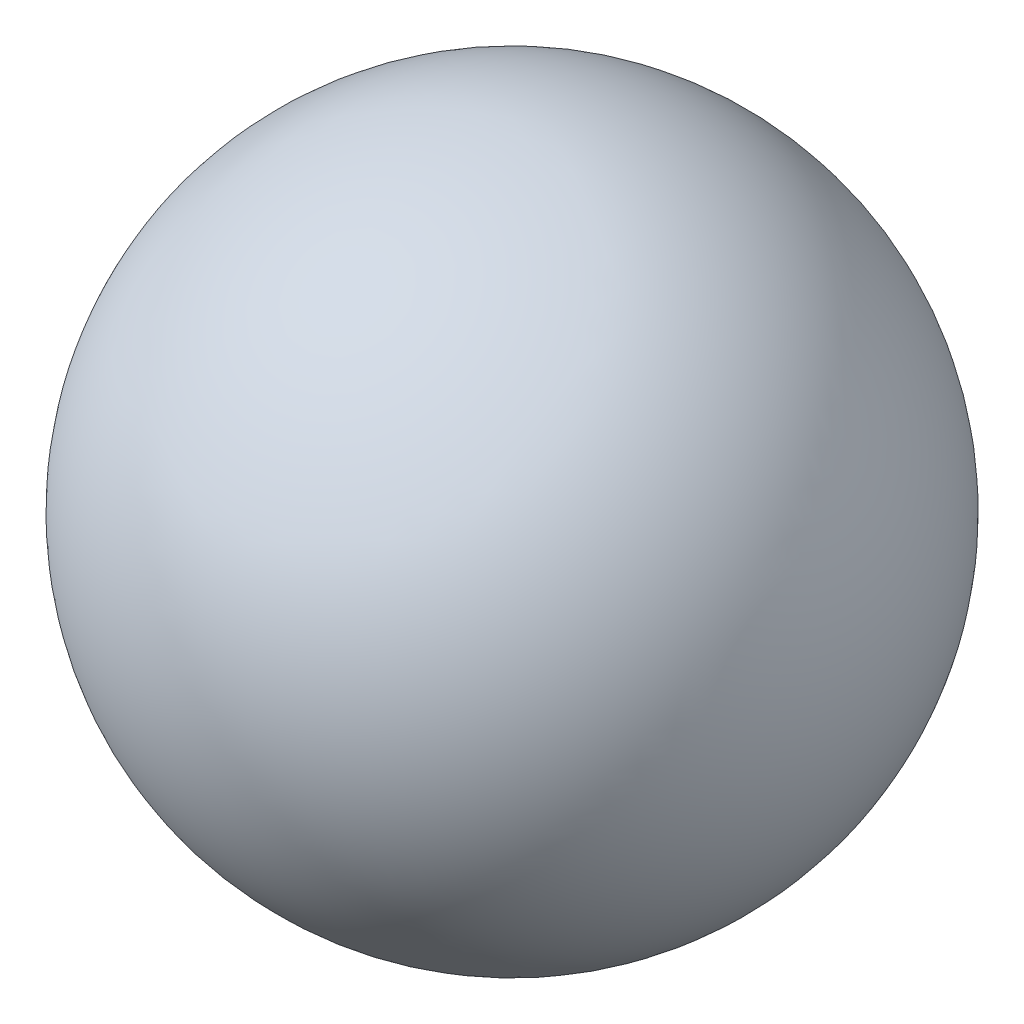
from build123d import *


with BuildPart() as part:
    # Esquisse1 → Base-Révolution (revolve)
    with BuildSketch(Plane(origin=(0, 0, 0), x_dir=(1, 0, 0), z_dir=(0, 1, 0))):
        with BuildLine():
            Line((1.15, 3.95), (6.25, 3.95))
            ThreePointArc((6.25, 3.95), (3.7, 6.5), (1.15, 3.95))
        make_face()
    revolve(axis=Axis((-0.3, 0, -3.95), (1, 0, 0)))


solid = part.part
